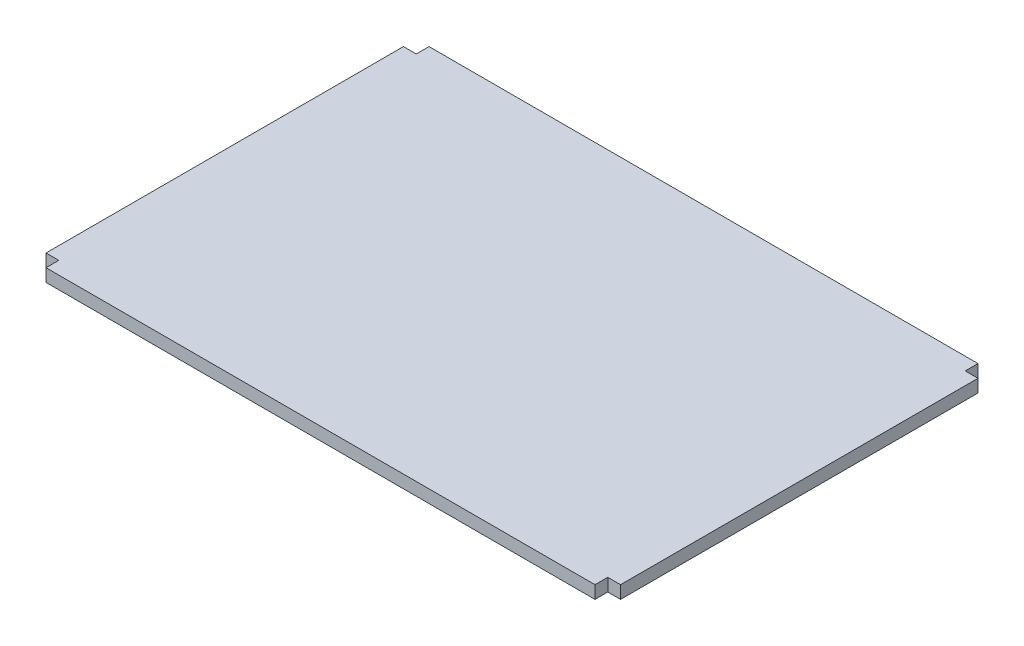
from build123d import *

# Parameters (mm, degrees)
SKETCH2_W           = 900
SKETCH2_H           = 600
BOSS_EXTRUDE1_DEPTH = 20
SKETCH4_W           = 16.490398782
SKETCH4_H           = 20.158553923
BOSS_EXTRUDE3_DEPTH = 20
SKETCH7_W           = 20
SKETCH7_H           = 20
CUT_EXTRUDE2_DEPTH  = 20
SKETCH8_W           = 20
SKETCH8_H           = 20
CUT_EXTRUDE3_DEPTH  = 20
SKETCH10_W          = 20
SKETCH10_H          = 20
CUT_EXTRUDE4_DEPTH  = 20
SKETCH11_W          = 20
SKETCH11_H          = 20
CUT_EXTRUDE5_DEPTH  = 20


with BuildPart() as part:
    # Sketch2 → Boss-Extrude1 (new body)
    with BuildSketch(Plane(origin=(0, 0, 0), x_dir=(1, 0, 0), z_dir=(0, 1, 0))):
        Rectangle(SKETCH2_W, SKETCH2_H)
    extrude(amount=BOSS_EXTRUDE1_DEPTH)

    # Sketch4 → Boss-Extrude3 (add)
    with BuildSketch(Plane(origin=(0, 20, 0), x_dir=(1, 0, 0), z_dir=(0, 1, 0))):
        with Locations((441.754800609, 289.920723039)):
            Rectangle(SKETCH4_W, SKETCH4_H)
    extrude(amount=-BOSS_EXTRUDE3_DEPTH)

    # Sketch7 → Cut-Extrude2 (cut)
    with BuildSketch(Plane(origin=(0, 20, 0), x_dir=(1, 0, 0), z_dir=(0, 1, 0))):
        with Locations((440, 290)):
            Rectangle(SKETCH7_W, SKETCH7_H)
    extrude(amount=-CUT_EXTRUDE2_DEPTH, mode=Mode.SUBTRACT)

    # Sketch8 → Cut-Extrude3 (cut)
    with BuildSketch(Plane(origin=(0, 20, 0), x_dir=(1, 0, 0), z_dir=(0, 1, 0))):
        with Locations((440, -290)):
            Rectangle(SKETCH8_W, SKETCH8_H)
    extrude(amount=-CUT_EXTRUDE3_DEPTH, mode=Mode.SUBTRACT)

    # Sketch10 → Cut-Extrude4 (cut)
    with BuildSketch(Plane(origin=(0, 20, 0), x_dir=(1, 0, 0), z_dir=(0, 1, 0))):
        with Locations((-440, 290)):
            Rectangle(SKETCH10_W, SKETCH10_H)
    extrude(amount=-CUT_EXTRUDE4_DEPTH, mode=Mode.SUBTRACT)

    # Sketch11 → Cut-Extrude5 (cut)
    with BuildSketch(Plane(origin=(0, 20, 0), x_dir=(1, 0, 0), z_dir=(0, 1, 0))):
        with Locations((-440, -290)):
            Rectangle(SKETCH11_W, SKETCH11_H)
    extrude(amount=-CUT_EXTRUDE5_DEPTH, mode=Mode.SUBTRACT)


solid = part.part
